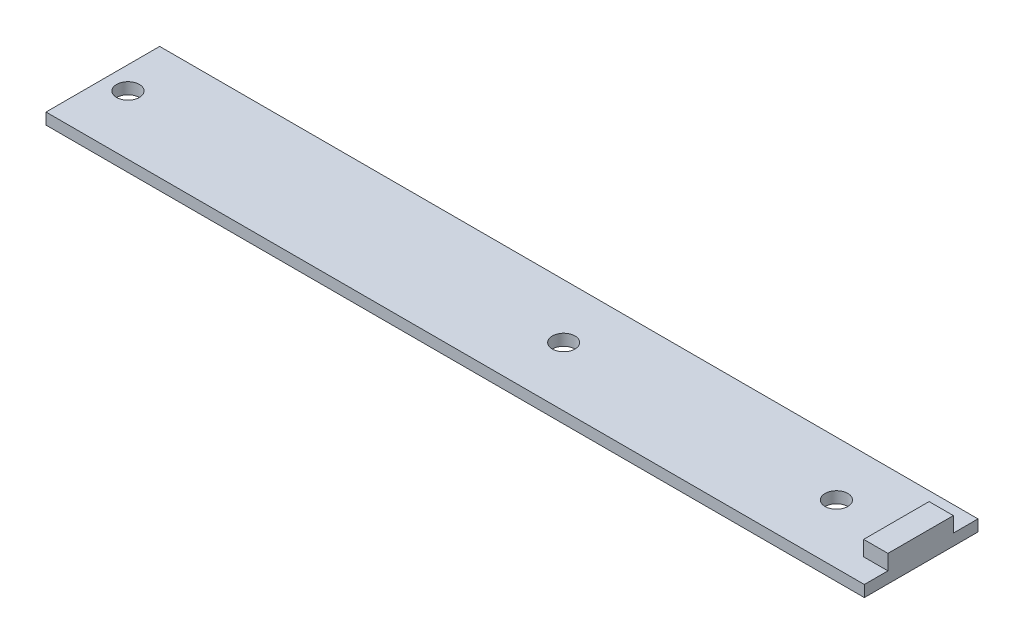
from build123d import *

# Parameters (mm, degrees)
SKETCH1_W           = 108
SKETCH1_H           = 15
BOSS_EXTRUDE1_DEPTH = 1.5
SKETCH2_W           = 3.202930222
SKETCH2_H           = 8.636913893
BOSS_EXTRUDE2_DEPTH = 2
SKETCH3_R           = 1.5
CUT_EXTRUDE1_DEPTH  = 2


with BuildPart() as part:
    # Sketch1 → Boss-Extrude1 (new body)
    with BuildSketch(Plane(origin=(0, 0, 0), x_dir=(1, 0, 0), z_dir=(0, 1, 0))):
        with Locations((54, -7.5)):
            Rectangle(SKETCH1_W, SKETCH1_H)
    extrude(amount=BOSS_EXTRUDE1_DEPTH)

    # Sketch2 → Boss-Extrude2 (add)
    with BuildSketch(Plane(origin=(0, 1.5, 0), x_dir=(1, 0, 0), z_dir=(0, 1, 0))):
        with Locations((106.398534889, -7.568326669)):
            Rectangle(SKETCH2_W, SKETCH2_H)
    extrude(amount=BOSS_EXTRUDE2_DEPTH)

    # Sketch3 → Cut-Extrude1 (cut)
    with BuildSketch(Plane(origin=(0, 0, 0), x_dir=(-1, 0, 0), z_dir=(0, -1, 0))):
        with Locations(Location((-3, -7.180959686, 0), (0, 0, 90))):
            Circle(SKETCH3_R)
        with Locations(Location((-60.5, -7.180959686, 0), (0, 0, 90))):
            Circle(SKETCH3_R)
        with Locations(Location((-96.5, -7.180959686, 0), (0, 0, 90))):
            Circle(SKETCH3_R)
    extrude(amount=-CUT_EXTRUDE1_DEPTH, mode=Mode.SUBTRACT)


solid = part.part
